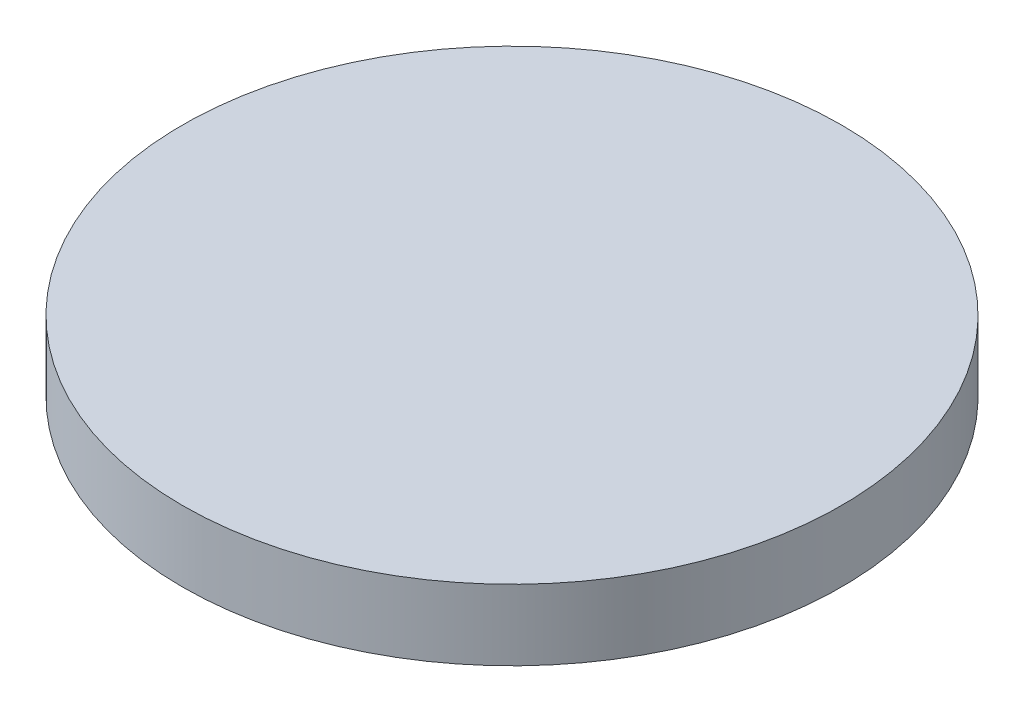
from build123d import *

# Parameters (mm, degrees)
SKETCH1_R           = 14
BOSS_EXTRUDE1_DEPTH = 3


with BuildPart() as part:
    # Sketch1 → Boss-Extrude1 (new body)
    with BuildSketch(Plane(origin=(0, 0, 0), x_dir=(1, 0, 0), z_dir=(0, 1, 0))):
        with Locations(Location((0, 0, 0), (0, 0, 270))):
            Circle(SKETCH1_R)
    extrude(amount=BOSS_EXTRUDE1_DEPTH)


solid = part.part
